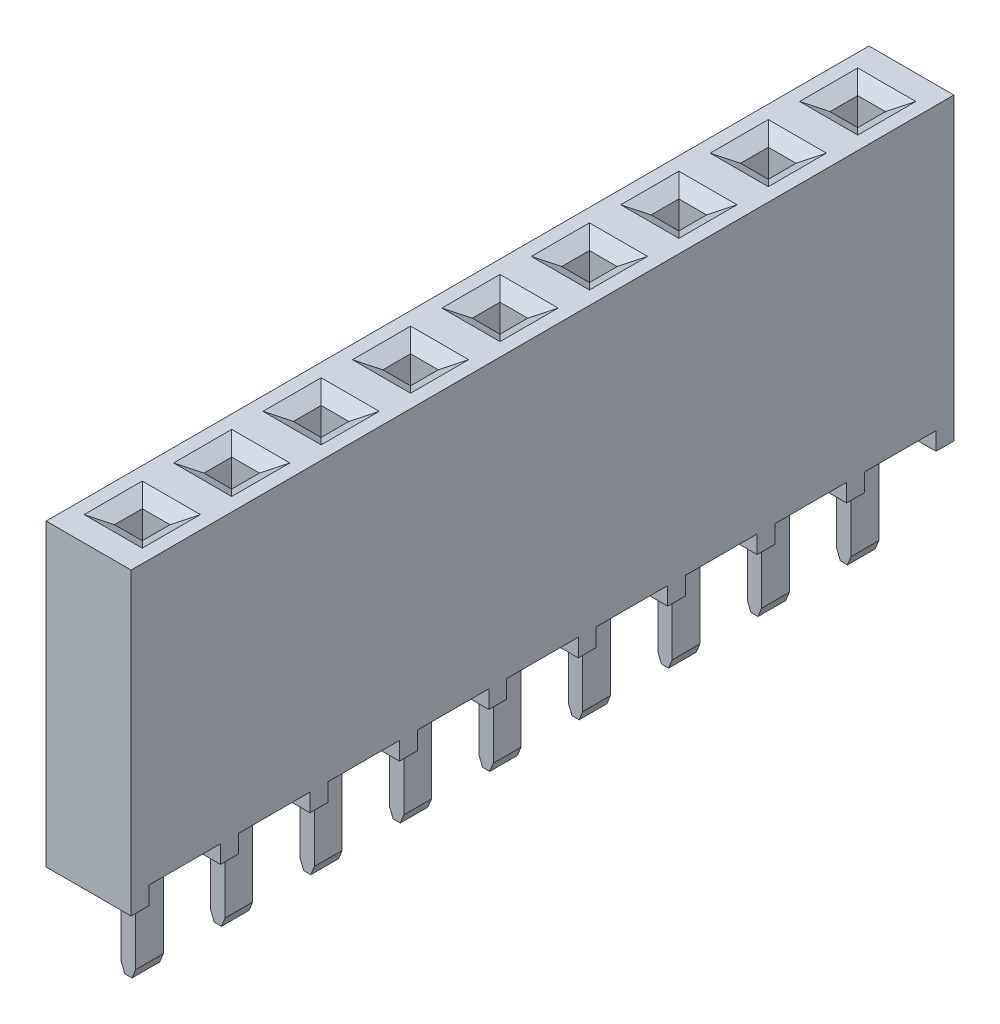
from build123d import *

# Parameters (mm, degrees)
SKETCH1_W                   = 2.413
SKETCH1_H                   = 23.368
MAIN_BODY_DEPTH             = 8.509
CUT_EXTRUDE2_REACH          = 16.654
SKETCH5_W                   = 2.032
SKETCH5_H                   = 0.508
LPATTERN1_COUNT             = 9
LPATTERN1_PITCH             = 2.54
SKETCH2_W                   = 0.7874
SKETCH2_H                   = 0.7874
CUT_EXTRUDE1_DEPTH          = 15.5042952
CHAMFER1_SIZE               = 0.4318
CHAMFER1_SIZE2              = 0.249299846
LPATTERN2_COUNT             = 9
LPATTERN2_PITCH             = 2.54
CHAMFER1_OF_LPATTERN2_SIZE2 = 0.249299846
CHAMFER1_OF_LPATTERN2_SIZE  = 0.4318
PIN_DEPTH                   = 0.3937
LPATTERN4_COUNT             = 9
LPATTERN4_PITCH             = 2.54


with BuildPart() as part:
    # Sketch1 → Main Body (new body)
    with BuildSketch(Plane(origin=(0, 0, 0), x_dir=(1, 0, 0), z_dir=(0, 1, 0))):
        Rectangle(SKETCH1_W, SKETCH1_H)
    extrude(amount=MAIN_BODY_DEPTH)

    # Sketch5 → Cut-Extrude2 (cut, up to next)
    with BuildSketch(Plane(origin=(1.2065, 0, 0), x_dir=(0, 0, -1), z_dir=(1, 0, 0)), mode=Mode.PRIVATE) as cut_extrude2_sk1:
        with Locations((10.16, 0.254)):
            Rectangle(SKETCH5_W, SKETCH5_H)
    cut_extrude2_tool1 = extrude(cut_extrude2_sk1.sketch, amount=-CUT_EXTRUDE2_REACH, mode=Mode.PRIVATE) & part.part
    cut_extrude2 = cut_extrude2_tool1.solids().sort_by_distance((1.2065, 0.254, -10.16))[0]
    add(cut_extrude2, mode=Mode.SUBTRACT)

    # LPattern1: Cut-Extrude2 ×9
    with Locations(*[(0, 0, i * LPATTERN1_PITCH) for i in range(1, LPATTERN1_COUNT)]):
        add(cut_extrude2, mode=Mode.SUBTRACT)

    # Sketch2 → Cut-Extrude1 (cut, through all)
    with BuildSketch(Plane(origin=(0, 8.509, 0), x_dir=(-1, 0, 0), z_dir=(0, 1, 0))):
        with Locations((0, -10.16)):
            Rectangle(SKETCH2_W, SKETCH2_H)
    cut_extrude1 = extrude(amount=-CUT_EXTRUDE1_DEPTH, mode=Mode.SUBTRACT)

    # Chamfer1
    chamfer1_edges = [part.edges().sort_by_distance(p)[0] for p in [
        (0.3937, 8.509, -10.16),
        (0, 8.509, -10.5537),
        (-0.3937, 8.509, -10.16),
        (0, 8.509, -9.7663),
    ]]
    chamfer1_side = [part.faces().sort_by_distance(p)[0] for p in [
        (0, 8.509, 0.112955495),
    ]]
    chamfer(chamfer1_edges, length=CHAMFER1_SIZE, length2=CHAMFER1_SIZE2, reference=chamfer1_side[0])

    # LPattern2: Cut-Extrude1 ×9
    with Locations(*[(0, 0, i * LPATTERN2_PITCH) for i in range(1, LPATTERN2_COUNT)]):
        add(cut_extrude1, mode=Mode.SUBTRACT)

    # Chamfer1 of LPattern2
    chamfer1_of_lpattern2_edges = [part.edges().sort_by_distance(p)[0] for p in [
        (0.3937, 8.509, -7.62),
        (0, 8.509, -8.0137),
        (-0.3937, 8.509, -7.62),
        (0, 8.509, -7.2263),
        (0.3937, 8.509, -5.08),
        (0, 8.509, -5.4737),
        (-0.3937, 8.509, -5.08),
        (0, 8.509, -4.6863),
        (0.3937, 8.509, -2.54),
        (0, 8.509, -2.9337),
        (-0.3937, 8.509, -2.54),
        (0, 8.509, -2.1463),
        (0.3937, 8.509, 0),
        (0, 8.509, -0.3937),
        (-0.3937, 8.509, 0),
        (0, 8.509, 0.3937),
        (0.3937, 8.509, 2.54),
        (0, 8.509, 2.1463),
        (-0.3937, 8.509, 2.54),
        (0, 8.509, 2.9337),
        (0.3937, 8.509, 5.08),
        (0, 8.509, 4.6863),
        (-0.3937, 8.509, 5.08),
        (0, 8.509, 5.4737),
        (0.3937, 8.509, 7.62),
        (0, 8.509, 7.2263),
        (-0.3937, 8.509, 7.62),
        (0, 8.509, 8.0137),
        (0.3937, 8.509, 10.16),
        (0, 8.509, 9.7663),
        (-0.3937, 8.509, 10.16),
        (0, 8.509, 10.5537),
    ]]
    chamfer(chamfer1_of_lpattern2_edges, length=CHAMFER1_OF_LPATTERN2_SIZE, length2=CHAMFER1_OF_LPATTERN2_SIZE2)

    # Sketch4 → PIN (add, symmetric)
    with BuildSketch(Plane(origin=(0, 0, -10.16), x_dir=(-1, 0, 0), z_dir=(0, 0, -1))):
        Polygon((-0.3937, 1.016), (0.3937, 1.016), (0.3937, 0.889), (0.2032, 0.889), (0.2032, -2.3876), (0.1016, -2.6416), (-0.1016, -2.6416), (-0.2032, -2.3876), (-0.2032, 0.889), (-0.3937, 0.889), align=None)
    pin = extrude(amount=PIN_DEPTH, both=True)

    # LPattern4: PIN ×9
    with Locations(*[(0, 0, i * LPATTERN4_PITCH) for i in range(1, LPATTERN4_COUNT)]):
        add(pin)


solid = part.part
